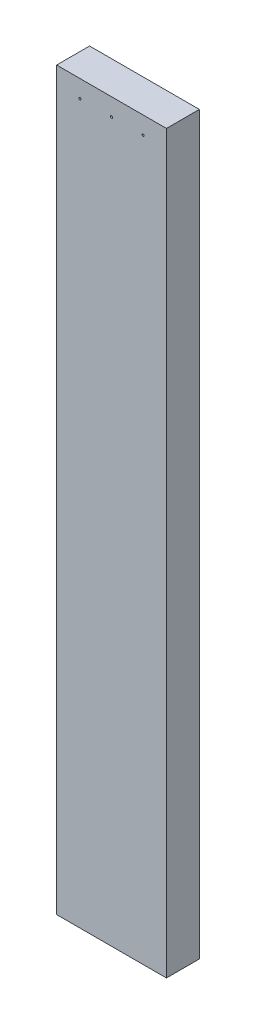
from build123d import *

# Parameters (mm, degrees)
SKETCH2_W               = 63.5
SKETCH2_H               = 19.05
BOSS_EXTRUDE1_DEPTH     = 425.45
CUT_EXTRUDE1_DEPTH      = 431.584318107
CUT_EXTRUDE1_DEPTH_BACK = 50.8
SKETCH3_R               = 0.635
SKETCH4_R               = 0.635
CUT_EXTRUDE2_DEPTH      = 431.584318107


with BuildPart() as part:
    # Sketch2 → Boss-Extrude1 (new body)
    with BuildSketch(Plane(origin=(0, 0, 0), x_dir=(1, 0, 0), z_dir=(0, 1, 0))):
        with Locations((31.75, 9.525)):
            Rectangle(SKETCH2_W, SKETCH2_H)
    extrude(amount=BOSS_EXTRUDE1_DEPTH)

    # Sketch3 → Cut-Extrude1 (cut, two sides: drawn at the far end of the back side and taken through both)
    with BuildSketch(Plane.XZ.offset(-CUT_EXTRUDE1_DEPTH_BACK)):
        with Locations(Location((13.4874, -9.525, 0), (0, 0, 270))):
            Circle(SKETCH3_R)
        with Locations(Location((31.75, -9.525, 0), (0, 0, 270))):
            Circle(SKETCH3_R)
        with Locations(Location((50.0126, -9.525, 0), (0, 0, 270))):
            Circle(SKETCH3_R)
    extrude(amount=CUT_EXTRUDE1_DEPTH + CUT_EXTRUDE1_DEPTH_BACK, mode=Mode.SUBTRACT)

    # Sketch4 → Cut-Extrude2 (cut, through all)
    with BuildSketch(Plane.XY):
        with Locations((31.75, 415.29)):
            Circle(SKETCH4_R)
        with Locations((50.0126, 415.29)):
            Circle(SKETCH4_R)
        with Locations(Location((13.4874, 415.29, 0), (0, 0, 180))):
            Circle(SKETCH4_R)
    extrude(amount=-CUT_EXTRUDE2_DEPTH, mode=Mode.SUBTRACT)


solid = part.part
